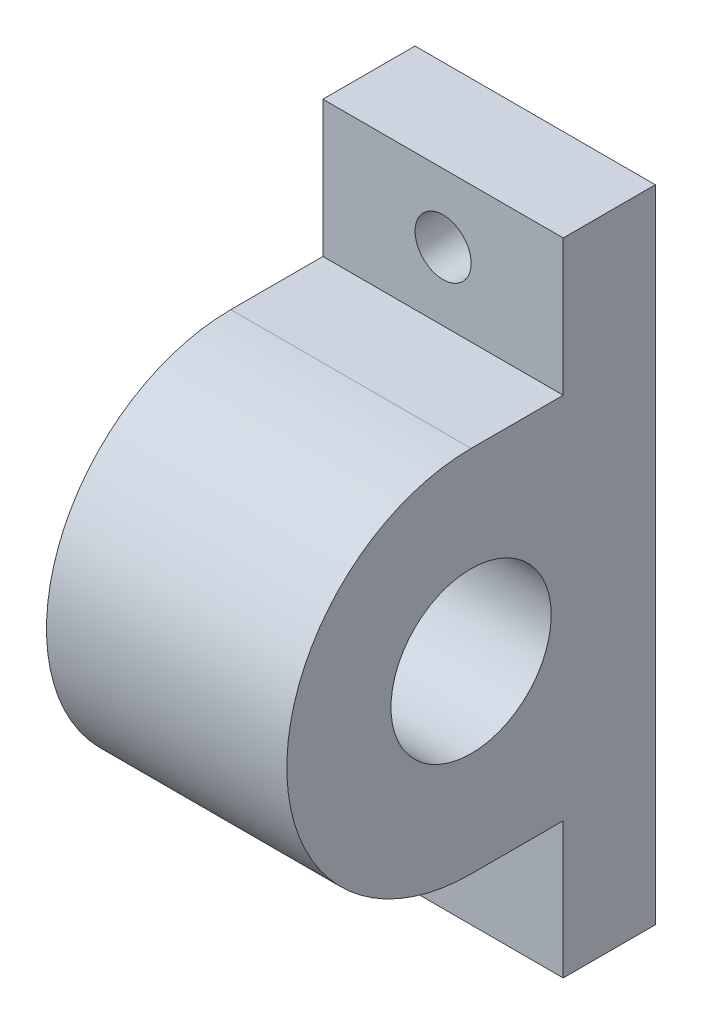
from build123d import *

# Parameters (mm, degrees)
SKETCH1_W           = 15
SKETCH1_H           = 40
BOSS_EXTRUDE1_DEPTH = 23
SKETCH2_OUTSIDE_W   = 34.704
SKETCH2_OUTSIDE_H   = 51.704
CUT_EXTRUDE1_DEPTH  = 207.508357771
SKETCH3_R           = 5
CUT_EXTRUDE2_DEPTH  = 207.508357771
SKETCH4_R           = 1.75
CUT_EXTRUDE3_DEPTH  = 17


with BuildPart() as part:
    # Sketch1 → Boss-Extrude1 (new body)
    with BuildSketch(Plane.XY):
        with Locations((243.381155173, -184.674624292)):
            Rectangle(SKETCH1_W, SKETCH1_H)
    extrude(amount=BOSS_EXTRUDE1_DEPTH)

    # Sketch2 outside → Cut-Extrude1 (cut, through all)
    with BuildSketch(Plane(origin=(250.881155173, 0, 0), x_dir=(0, 0, -1), z_dir=(1, 0, 0))):
        with Locations((-11.5, -184.675)):
            Rectangle(SKETCH2_OUTSIDE_W, SKETCH2_OUTSIDE_H)
        with BuildLine():
            Line((-11.5, -173.174624292), (-5.75, -173.174624292))
            Line((-5.75, -173.174624292), (-5.75, -164.674624292))
            Line((-5.75, -164.674624292), (0, -164.674624292))
            Line((0, -164.674624292), (0, -204.674624292))
            Line((0, -204.674624292), (-5.75, -204.674624292))
            Line((-5.75, -204.674624292), (-5.75, -196.174624292))
            Line((-5.75, -196.174624292), (-11.5, -196.174624292))
            ThreePointArc((-11.5, -196.174624292), (-23, -184.674624292), (-11.5, -173.174624292))
        make_face(mode=Mode.SUBTRACT)
    extrude(amount=-CUT_EXTRUDE1_DEPTH, mode=Mode.SUBTRACT)

    # Sketch3 → Cut-Extrude2 (cut, through all)
    with BuildSketch(Plane(origin=(250.881155173, 0, 0), x_dir=(0, 0, -1), z_dir=(1, 0, 0))):
        with Locations((-11.5, -184.674624292)):
            Circle(SKETCH3_R)
    extrude(amount=-CUT_EXTRUDE2_DEPTH, mode=Mode.SUBTRACT)

    # Sketch4 → Cut-Extrude3 (cut)
    with BuildSketch(Plane.XY.offset(5.75)):
        with Locations((243.381155173, -200.424624292)):
            Circle(SKETCH4_R)
        with Locations((243.381155173, -168.924624292)):
            Circle(SKETCH4_R)
    extrude(amount=-CUT_EXTRUDE3_DEPTH, mode=Mode.SUBTRACT)


solid = part.part
